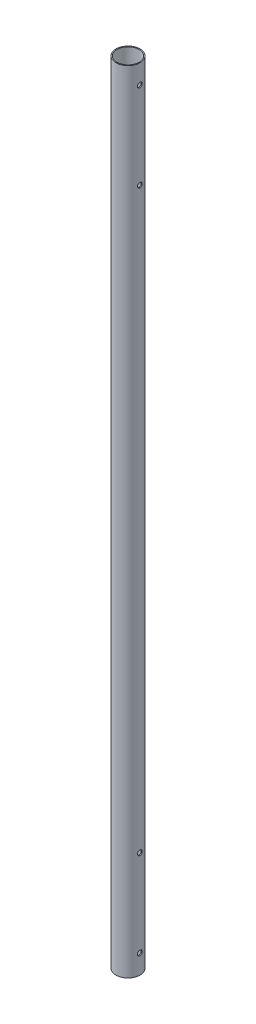
from build123d import *

# Parameters (mm, degrees)
SKETCH_1_R          = 12.5
SKETCH_1_R_2        = 11.5
EXTRUDE_1_DEPTH     = 820
SKETCH_2_R          = 2.5
CUT_EXTRUDE_1_DEPTH = 821.190526646


with BuildPart() as part:
    # Эскиз1 → Вытянуть-Тонкостенный1 (new body)
    with BuildSketch(Plane(origin=(0, 0, 0), x_dir=(1, 0, 0), z_dir=(0, 1, 0))):
        Circle(SKETCH_1_R)
        Circle(SKETCH_1_R_2, mode=Mode.SUBTRACT)
    extrude(amount=EXTRUDE_1_DEPTH)

    # Эскиз2 → Вырез-Вытянуть1 (cut, symmetric)
    with BuildSketch(Plane(origin=(0, 0, 0), x_dir=(0, 0, -1), z_dir=(1, 0, 0))):
        with Locations((0, 110)):
            Circle(SKETCH_2_R)
        with Locations((0, 20)):
            Circle(SKETCH_2_R)
    cut_extrude_1 = extrude(amount=CUT_EXTRUDE_1_DEPTH, both=True, mode=Mode.SUBTRACT)

    # Зеркальное отражение1: Вырез-Вытянуть1 across plane
    add(cut_extrude_1.mirror(Plane(origin=(0, 410, 0), x_dir=(0, 0, 1), z_dir=(0, -1, 0))), mode=Mode.SUBTRACT)


solid = part.part
